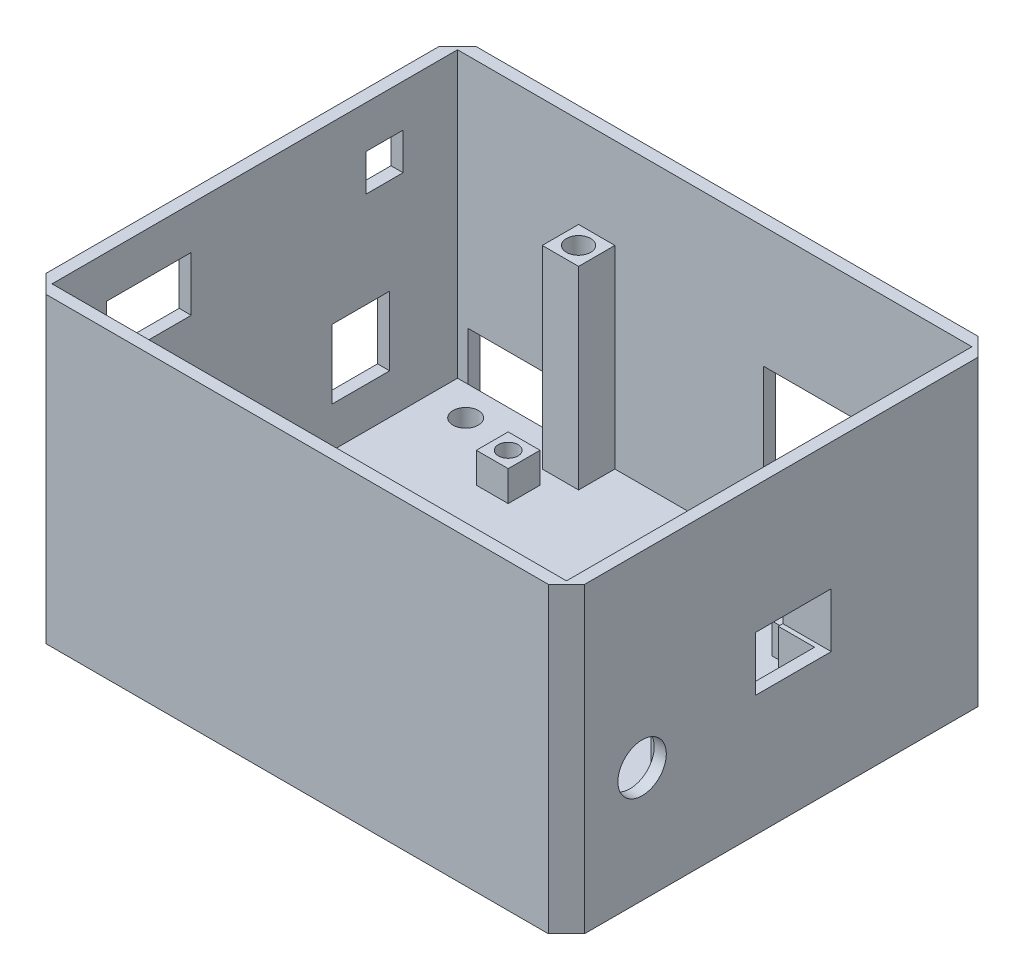
from build123d import *

# Parameters (mm, degrees)
SKETCH1_W           = 85
SKETCH1_H           = 67
SKETCH1_R           = 2.1
BOSS_EXTRUDE1_DEPTH = 3
SKETCH1_3_W         = 89
SKETCH1_3_H         = 71
SKETCH1_3_W_2       = 85
SKETCH1_3_H_2       = 67
BOSS_EXTRUDE2_DEPTH = 50
CHAMFER1_SIZE       = 3
SKETCH2_W           = 6
SKETCH2_H           = 6
SKETCH2_R           = 2
BOSS_EXTRUDE3_DEPTH = 32
SKETCH4_W           = 6.06
SKETCH4_H           = 5.26
SKETCH4_R           = 1.625
SKETCH4_W_2         = 5.26
BOSS_EXTRUDE4_DEPTH = 5
SKETCH5_W           = 15
SKETCH5_H           = 20
SKETCH5_W_2         = 17
SKETCH5_H_2         = 11
CUT_EXTRUDE1_DEPTH  = 3
SKETCH7_R           = 4
SKETCH7_W           = 12.5
SKETCH7_H           = 9
CUT_EXTRUDE2_DEPTH  = 10
SKETCH6_W           = 9.543049048
SKETCH6_H           = 11.406034719
SKETCH6_W_2         = 14
SKETCH6_H_2         = 9
SKETCH6_W_3         = 6.1
SKETCH6_H_3         = 6.1
CUT_EXTRUDE3_DEPTH  = 10


with BuildPart() as part:
    # Sketch1 → Boss-Extrude1 (new body)
    with BuildSketch(Plane(origin=(0, 0, 0), x_dir=(1, 0, 0), z_dir=(0, 1, 0))):
        Rectangle(SKETCH1_W, SKETCH1_H)
        with Locations(Location((36.156716418, -28.5, 0), (0, 0, 270))):
            Circle(SKETCH1_R, mode=Mode.SUBTRACT)
        with Locations(Location((36.156716418, 28.5, 0), (0, 0, 270))):
            Circle(SKETCH1_R, mode=Mode.SUBTRACT)
        with Locations(Location((-36.156716418, 28.5, 0), (0, 0, 270))):
            Circle(SKETCH1_R, mode=Mode.SUBTRACT)
    extrude(amount=BOSS_EXTRUDE1_DEPTH)

    # Sketch1<3> → Boss-Extrude2 (add)
    with BuildSketch(Plane(origin=(0, 0, 0), x_dir=(1, 0, 0), z_dir=(0, 1, 0))):
        Rectangle(SKETCH1_3_W, SKETCH1_3_H)
        Rectangle(SKETCH1_3_W_2, SKETCH1_3_H_2, mode=Mode.SUBTRACT)
    extrude(amount=BOSS_EXTRUDE2_DEPTH)

    # Chamfer1
    chamfer1_edges = [part.edges().sort_by_distance(p)[0] for p in [
        (-44.5, 25, -35.5),
        (-44.5, 25, 35.5),
        (44.5, 25, 35.5),
        (44.5, 25, -35.5),
    ]]
    chamfer(chamfer1_edges, length=CHAMFER1_SIZE)

    # Sketch2 → Boss-Extrude3 (add)
    # profile 1 of 3: a face of its own
    with BuildSketch(Plane(origin=(0, 3, 0), x_dir=(1, 0, 0), z_dir=(0, 1, 0))):
        with Locations((-19.5, 30.5)):
            Rectangle(SKETCH2_W, SKETCH2_H)
        with Locations(Location((-19.5, 30.5, 0), (0, 0, 90))):
            Circle(SKETCH2_R, mode=Mode.SUBTRACT)
    # profile 2 of 3: a face of its own
    with BuildSketch(Plane(origin=(0, 3, 0), x_dir=(1, 0, 0), z_dir=(0, 1, 0))):
        with Locations((39.5, 10.5)):
            Rectangle(SKETCH2_W, SKETCH2_H)
        with Locations(Location((39.5, 10.5, 0), (0, 0, 90))):
            Circle(SKETCH2_R, mode=Mode.SUBTRACT)
    # profile 3 of 3: a face of its own
    with BuildSketch(Plane(origin=(0, 3, 0), x_dir=(1, 0, 0), z_dir=(0, 1, 0))):
        with Locations((39.5, -10.5)):
            Rectangle(SKETCH2_W, SKETCH2_H)
        with Locations(Location((39.5, -10.5, 0), (0, 0, 90))):
            Circle(SKETCH2_R, mode=Mode.SUBTRACT)
    extrude(amount=BOSS_EXTRUDE3_DEPTH)

    # Sketch4 → Boss-Extrude4 (add)
    # profile 1 of 4: a face of its own
    with BuildSketch(Plane(origin=(0, 3, 0), x_dir=(1, 0, 0), z_dir=(0, 1, 0))):
        with Locations((-39.47, -30.87)):
            Rectangle(SKETCH4_W, SKETCH4_H)
        with Locations(Location((-39.47, -30.87, 0), (0, 0, 270))):
            Circle(SKETCH4_R, mode=Mode.SUBTRACT)
    # profile 2 of 4: a face of its own
    with BuildSketch(Plane(origin=(0, 3, 0), x_dir=(1, 0, 0), z_dir=(0, 1, 0))):
        with Locations((-23, 22.37)):
            Rectangle(SKETCH4_W_2, SKETCH4_H)
        with Locations(Location((-23, 22.37, 0), (0, 0, 270))):
            Circle(SKETCH4_R, mode=Mode.SUBTRACT)
    # profile 3 of 4: a face of its own
    with BuildSketch(Plane(origin=(0, 3, 0), x_dir=(1, 0, 0), z_dir=(0, 1, 0))):
        with Locations((26.22, 22.37)):
            Rectangle(SKETCH4_W, SKETCH4_H)
        with Locations(Location((26.22, 22.37, 0), (0, 0, 270))):
            Circle(SKETCH4_R, mode=Mode.SUBTRACT)
    # profile 4 of 4: a face of its own
    with BuildSketch(Plane(origin=(0, 3, 0), x_dir=(1, 0, 0), z_dir=(0, 1, 0))):
        with Locations((26.22, -30.87)):
            Rectangle(SKETCH4_W, SKETCH4_H)
        with Locations(Location((26.22, -30.87, 0), (0, 0, 270))):
            Circle(SKETCH4_R, mode=Mode.SUBTRACT)
    extrude(amount=BOSS_EXTRUDE4_DEPTH)

    # Sketch5 → Cut-Extrude1 (cut)
    with BuildSketch(Plane.XY.offset(-33.5)):
        with Locations((15.544213072, 20)):
            Rectangle(SKETCH5_W, SKETCH5_H)
        with Locations((-32.275786928, 5.5)):
            Rectangle(SKETCH5_W_2, SKETCH5_H_2)
    extrude(amount=-CUT_EXTRUDE1_DEPTH, mode=Mode.SUBTRACT)

    # Sketch7 → Cut-Extrude2 (cut)
    with BuildSketch(Plane(origin=(44.5, 0, 0), x_dir=(0, 0, -1), z_dir=(1, 0, 0))):
        with Locations((-23, 19)):
            Circle(SKETCH7_R)
        with Locations((2, 24.5)):
            Rectangle(SKETCH7_W, SKETCH7_H)
    extrude(amount=-CUT_EXTRUDE2_DEPTH, mode=Mode.SUBTRACT)

    # Sketch6 → Cut-Extrude3 (cut)
    with BuildSketch(Plane(origin=(-42.5, 0, 0), x_dir=(0, 0, -1), z_dir=(1, 0, 0))):
        with Locations((17.512756781, 15.365129708)):
            Rectangle(SKETCH6_W, SKETCH6_H)
        with Locations((-17.5, 38.5)):
            Rectangle(SKETCH6_W_2, SKETCH6_H_2)
        with Locations((21.45, 39.95)):
            Rectangle(SKETCH6_W_3, SKETCH6_H_3)
    extrude(amount=-CUT_EXTRUDE3_DEPTH, mode=Mode.SUBTRACT)


solid = part.part
